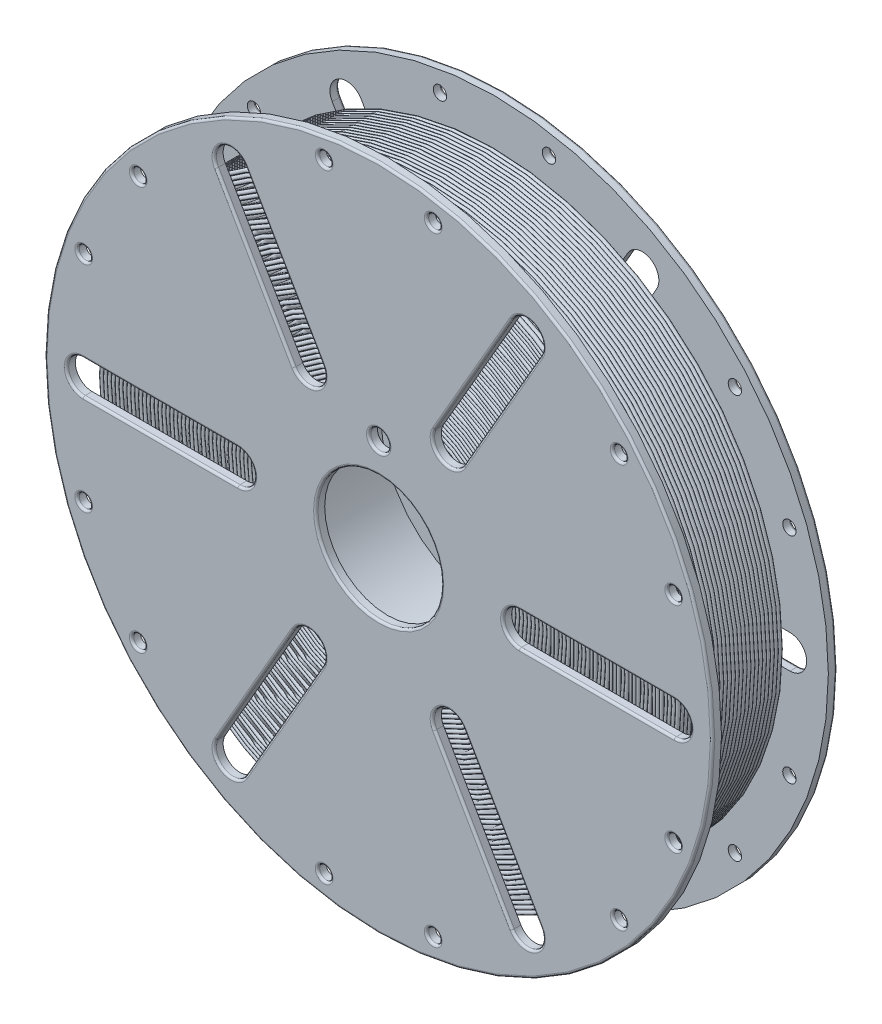
from build123d import *

# Parameters (mm, degrees)
SKETCH1_R           = 150
SKETCH1_R_2         = 28.25
SKETCH1_R_3         = 3
SKETCH1_R_4         = 4.5
BOSS_EXTRUDE1_DEPTH = 4
FILLET1_R           = 1
EXTRUDE_THIN1_START = -24
SKETCH2_R           = 55
SKETCH2_R_2         = 51
EXTRUDE_THIN1_DEPTH = 48


with BuildPart() as part:
    # Sketch1 → Boss-Extrude1 (new body)
    with BuildSketch(Plane.XY):
        Circle(SKETCH1_R)
        Circle(SKETCH1_R_2, mode=Mode.SUBTRACT)
        with Locations((132.496659531, -48.224840209)):
            Circle(SKETCH1_R_3, mode=Mode.SUBTRACT)
        with Locations((108.01226648, -90.633052966)):
            Circle(SKETCH1_R_3, mode=Mode.SUBTRACT)
        with Locations((24.484393051, -138.857893175)):
            Circle(SKETCH1_R_3, mode=Mode.SUBTRACT)
        with Locations((-24.484393051, -138.857893175)):
            Circle(SKETCH1_R_3, mode=Mode.SUBTRACT)
        with Locations((-108.01226648, -90.633052966)):
            Circle(SKETCH1_R_3, mode=Mode.SUBTRACT)
        with Locations((-132.496659531, -48.224840209)):
            Circle(SKETCH1_R_3, mode=Mode.SUBTRACT)
        with Locations((-132.496659531, 48.224840209)):
            Circle(SKETCH1_R_3, mode=Mode.SUBTRACT)
        with Locations((-108.01226648, 90.633052966)):
            Circle(SKETCH1_R_3, mode=Mode.SUBTRACT)
        with Locations((-24.484393051, 138.857893175)):
            Circle(SKETCH1_R_3, mode=Mode.SUBTRACT)
        with Locations((24.484393051, 138.857893175)):
            Circle(SKETCH1_R_3, mode=Mode.SUBTRACT)
        with Locations((108.01226648, 90.633052966)):
            Circle(SKETCH1_R_3, mode=Mode.SUBTRACT)
        with Locations((132.496659531, 48.224840209)):
            Circle(SKETCH1_R_3, mode=Mode.SUBTRACT)
        with Locations((0, 41.75)):
            Circle(SKETCH1_R_4, mode=Mode.SUBTRACT)
        with BuildLine():
            Line((63.25, 7.5), (132.75, 7.5))
            ThreePointArc((132.75, 7.5), (140.25, 0), (132.75, -7.5))
            Line((132.75, -7.5), (63.25, -7.5))
            ThreePointArc((63.25, -7.5), (55.75, 0), (63.25, 7.5))
        make_face(mode=Mode.SUBTRACT)
        with BuildLine():
            Line((38.120190528, -51.026106789), (72.870190528, -111.214872352))
            ThreePointArc((72.870190528, -111.214872352), (70.125, -121.460062881), (59.879809472, -118.714872352))
            Line((59.879809472, -118.714872352), (25.129809472, -58.526106789))
            ThreePointArc((25.129809472, -58.526106789), (27.875, -48.280916261), (38.120190528, -51.026106789))
        make_face(mode=Mode.SUBTRACT)
        with BuildLine():
            Line((-25.129809472, -58.526106789), (-59.879809472, -118.714872352))
            ThreePointArc((-59.879809472, -118.714872352), (-70.125, -121.460062881), (-72.870190528, -111.214872352))
            Line((-72.870190528, -111.214872352), (-38.120190528, -51.026106789))
            ThreePointArc((-38.120190528, -51.026106789), (-27.875, -48.280916261), (-25.129809472, -58.526106789))
        make_face(mode=Mode.SUBTRACT)
        with BuildLine():
            Line((-63.25, -7.5), (-132.75, -7.5))
            ThreePointArc((-132.75, -7.5), (-140.25, 0), (-132.75, 7.5))
            Line((-132.75, 7.5), (-63.25, 7.5))
            ThreePointArc((-63.25, 7.5), (-55.75, 0), (-63.25, -7.5))
        make_face(mode=Mode.SUBTRACT)
        with BuildLine():
            Line((-38.120190528, 51.026106789), (-72.870190528, 111.214872352))
            ThreePointArc((-72.870190528, 111.214872352), (-70.125, 121.460062881), (-59.879809472, 118.714872352))
            Line((-59.879809472, 118.714872352), (-25.129809472, 58.526106789))
            ThreePointArc((-25.129809472, 58.526106789), (-27.875, 48.280916261), (-38.120190528, 51.026106789))
        make_face(mode=Mode.SUBTRACT)
        with BuildLine():
            Line((25.129809472, 58.526106789), (59.879809472, 118.714872352))
            ThreePointArc((59.879809472, 118.714872352), (70.125, 121.460062881), (72.870190528, 111.214872352))
            Line((72.870190528, 111.214872352), (38.120190528, 51.026106789))
            ThreePointArc((38.120190528, 51.026106789), (27.875, 48.280916261), (25.129809472, 58.526106789))
        make_face(mode=Mode.SUBTRACT)
    extrude(amount=BOSS_EXTRUDE1_DEPTH)

    # Fillet1
    fillet1_edges = [part.edges().sort_by_distance(p)[0] for p in [
        (-111.01226648, -90.633052966, 0),
        (-135.496659531, -48.224840209, 0),
        (-135.496659531, 48.224840209, 0),
        (-111.01226648, 90.633052966, 0),
        (-27.484393051, 138.857893175, 0),
        (21.484393051, 138.857893175, 0),
        (105.01226648, 90.633052966, 0),
        (129.496659531, 48.224840209, 0),
        (-4.5, 41.75, 0),
        (55.75, 0, 0),
        (98, -7.5, 0),
        (140.25, 0, 0),
        (98, 7.5, 0),
        (-150, 0, 0),
        (105.01226648, -90.633052966, 0),
        (27.875, -48.280916261, 0),
        (42.504809472, -88.620489571, 0),
        (70.125, -121.460062881, 0),
        (55.495190528, -81.120489571, 0),
        (-27.875, -48.280916261, 0),
        (-55.495190528, -81.120489571, 0),
        (-70.125, -121.460062881, 0),
        (-42.504809472, -88.620489571, 0),
        (-28.25, 0, 0),
        (-55.75, 0, 0),
        (-98, 7.5, 0),
        (-140.25, 0, 0),
        (-98, -7.5, 0),
        (-27.875, 48.280916261, 0),
        (-42.504809472, 88.620489571, 0),
        (-70.125, 121.460062881, 0),
        (-55.495190528, 81.120489571, 0),
        (27.875, 48.280916261, 0),
        (55.495190528, 81.120489571, 0),
        (70.125, 121.460062881, 0),
        (42.504809472, 88.620489571, 0),
        (129.496659531, -48.224840209, 0),
        (21.484393051, -138.857893175, 0),
        (-27.484393051, -138.857893175, 0),
    ]]
    fillet(fillet1_edges, radius=FILLET1_R)


with BuildPart() as body_2:
    # Mirror2: mirrored copy
    add(part.part.mirror(Plane.XY.offset(28)))


with BuildPart() as part_1:
    add(part.part)

    add(body_2.part)  # Extrude-Thin1 merges body 2
    # Sketch2 → Extrude-Thin1 (add)
    with BuildSketch(Plane.XY.offset(28).offset(EXTRUDE_THIN1_START)):
        Circle(SKETCH2_R)
        Circle(SKETCH2_R_2, mode=Mode.SUBTRACT)
    extrude(amount=EXTRUDE_THIN1_DEPTH)


with BuildPart() as body_2_2:
    # Sketch3 → Revolve1 (revolve)
    with BuildSketch(Plane(origin=(0, 0, 0), x_dir=(0, 0, -1), z_dir=(1, 0, 0)), mode=Mode.PRIVATE) as revolve1_sk:
        with BuildLine():
            Line((-50.787875711, 55), (-5.287875711, 55))
            ThreePointArc((-5.287875711, 55), (-4.412875711, 55.875), (-5.287875711, 56.75))
            ThreePointArc((-5.287875711, 56.75), (-4.412875711, 57.625), (-5.287875711, 58.5))
            ThreePointArc((-5.287875711, 58.5), (-4.412875711, 59.375), (-5.287875711, 60.25))
            ThreePointArc((-5.287875711, 60.25), (-4.412875711, 61.125), (-5.287875711, 62))
            ThreePointArc((-5.287875711, 62), (-4.412875711, 62.875), (-5.287875711, 63.75))
            ThreePointArc((-5.287875711, 63.75), (-4.412875711, 64.625), (-5.287875711, 65.5))
            ThreePointArc((-5.287875711, 65.5), (-4.412875711, 66.375), (-5.287875711, 67.25))
            ThreePointArc((-5.287875711, 67.25), (-4.412875711, 68.125), (-5.287875711, 69))
            ThreePointArc((-5.287875711, 69), (-4.412875711, 69.875), (-5.287875711, 70.75))
            ThreePointArc((-5.287875711, 70.75), (-4.412875711, 71.625), (-5.287875711, 72.5))
            ThreePointArc((-5.287875711, 72.5), (-4.412875711, 73.375), (-5.287875711, 74.25))
            ThreePointArc((-5.287875711, 74.25), (-4.412875711, 75.125), (-5.287875711, 76))
            ThreePointArc((-5.287875711, 76), (-4.412875711, 76.875), (-5.287875711, 77.75))
            ThreePointArc((-5.287875711, 77.75), (-4.412875711, 78.625), (-5.287875711, 79.5))
            ThreePointArc((-5.287875711, 79.5), (-4.412875711, 80.375), (-5.287875711, 81.25))
            ThreePointArc((-5.287875711, 81.25), (-4.412875711, 82.125), (-5.287875711, 83))
            ThreePointArc((-5.287875711, 83), (-4.412875711, 83.875), (-5.287875711, 84.75))
            ThreePointArc((-5.287875711, 84.75), (-4.412875711, 85.625), (-5.287875711, 86.5))
            ThreePointArc((-5.287875711, 86.5), (-4.412875711, 87.375), (-5.287875711, 88.25))
            ThreePointArc((-5.287875711, 88.25), (-4.412875711, 89.125), (-5.287875711, 90))
            ThreePointArc((-5.287875711, 90), (-4.412875711, 90.875), (-5.287875711, 91.75))
            ThreePointArc((-5.287875711, 91.75), (-4.412875711, 92.625), (-5.287875711, 93.5))
            ThreePointArc((-5.287875711, 93.5), (-4.412875711, 94.375), (-5.287875711, 95.25))
            ThreePointArc((-5.287875711, 95.25), (-4.412875711, 96.125), (-5.287875711, 97))
            ThreePointArc((-5.287875711, 97), (-4.412875711, 97.875), (-5.287875711, 98.75))
            ThreePointArc((-5.287875711, 98.75), (-4.412875711, 99.625), (-5.287875711, 100.5))
            ThreePointArc((-5.287875711, 100.5), (-4.412875711, 101.375), (-5.287875711, 102.25))
            ThreePointArc((-5.287875711, 102.25), (-4.412875711, 103.125), (-5.287875711, 104))
            ThreePointArc((-5.287875711, 104), (-4.412875711, 104.875), (-5.287875711, 105.75))
            ThreePointArc((-5.287875711, 105.75), (-4.412875711, 106.625), (-5.287875711, 107.5))
            ThreePointArc((-5.287875711, 107.5), (-4.412875711, 108.375), (-5.287875711, 109.25))
            ThreePointArc((-5.287875711, 109.25), (-4.412875711, 110.125), (-5.287875711, 111))
            ThreePointArc((-5.287875711, 111), (-4.412875711, 111.875), (-5.287875711, 112.75))
            ThreePointArc((-5.287875711, 112.75), (-4.412875711, 113.625), (-5.287875711, 114.5))
            ThreePointArc((-5.287875711, 114.5), (-4.412875711, 115.375), (-5.287875711, 116.25))
            ThreePointArc((-5.287875711, 116.25), (-4.412875711, 117.125), (-5.287875711, 118))
            ThreePointArc((-5.287875711, 118), (-4.412875711, 118.875), (-5.287875711, 119.75))
            ThreePointArc((-5.287875711, 119.75), (-4.412875711, 120.625), (-5.287875711, 121.5))
            ThreePointArc((-5.287875711, 121.5), (-4.412875711, 122.375), (-5.287875711, 123.25))
            ThreePointArc((-5.287875711, 123.25), (-4.412875711, 124.125), (-5.287875711, 125))
            ThreePointArc((-5.287875711, 125), (-4.412875711, 125.875), (-5.287875711, 126.75))
            ThreePointArc((-5.287875711, 126.75), (-4.412875711, 127.625), (-5.287875711, 128.5))
            ThreePointArc((-5.287875711, 128.5), (-4.669157278, 129.993718434), (-6.162875711, 129.375))
            ThreePointArc((-6.162875711, 129.375), (-7.037875711, 130.25), (-7.912875711, 129.375))
            ThreePointArc((-7.912875711, 129.375), (-8.787875711, 130.25), (-9.662875711, 129.375))
            ThreePointArc((-9.662875711, 129.375), (-10.537875711, 130.25), (-11.412875711, 129.375))
            ThreePointArc((-11.412875711, 129.375), (-12.287875711, 130.25), (-13.162875711, 129.375))
            ThreePointArc((-13.162875711, 129.375), (-14.037875711, 130.25), (-14.912875711, 129.375))
            ThreePointArc((-14.912875711, 129.375), (-15.787875711, 130.25), (-16.662875711, 129.375))
            ThreePointArc((-16.662875711, 129.375), (-17.537875711, 130.25), (-18.412875711, 129.375))
            ThreePointArc((-18.412875711, 129.375), (-19.287875711, 130.25), (-20.162875711, 129.375))
            ThreePointArc((-20.162875711, 129.375), (-21.037875711, 130.25), (-21.912875711, 129.375))
            ThreePointArc((-21.912875711, 129.375), (-22.787875711, 130.25), (-23.662875711, 129.375))
            ThreePointArc((-23.662875711, 129.375), (-24.537875711, 130.25), (-25.412875711, 129.375))
            ThreePointArc((-25.412875711, 129.375), (-26.287875711, 130.25), (-27.162875711, 129.375))
            ThreePointArc((-27.162875711, 129.375), (-28.037875711, 130.25), (-28.912875711, 129.375))
            ThreePointArc((-28.912875711, 129.375), (-29.787875711, 130.25), (-30.662875711, 129.375))
            ThreePointArc((-30.662875711, 129.375), (-31.537875711, 130.25), (-32.412875711, 129.375))
            ThreePointArc((-32.412875711, 129.375), (-33.287875711, 130.25), (-34.162875711, 129.375))
            ThreePointArc((-34.162875711, 129.375), (-35.037875711, 130.25), (-35.912875711, 129.375))
            ThreePointArc((-35.912875711, 129.375), (-36.787875711, 130.25), (-37.662875711, 129.375))
            ThreePointArc((-37.662875711, 129.375), (-38.537875711, 130.25), (-39.412875711, 129.375))
            ThreePointArc((-39.412875711, 129.375), (-40.287875711, 130.25), (-41.162875711, 129.375))
            ThreePointArc((-41.162875711, 129.375), (-42.037875711, 130.25), (-42.912875711, 129.375))
            ThreePointArc((-42.912875711, 129.375), (-43.787875711, 130.25), (-44.662875711, 129.375))
            ThreePointArc((-44.662875711, 129.375), (-45.537875711, 130.25), (-46.412875711, 129.375))
            ThreePointArc((-46.412875711, 129.375), (-47.287875711, 130.25), (-48.162875711, 129.375))
            ThreePointArc((-48.162875711, 129.375), (-49.037875711, 130.25), (-49.912875711, 129.375))
            ThreePointArc((-49.912875711, 129.375), (-51.406594145, 129.993718434), (-50.787875711, 128.5))
            ThreePointArc((-50.787875711, 128.5), (-51.662875711, 127.625), (-50.787875711, 126.75))
            ThreePointArc((-50.787875711, 126.75), (-51.662875711, 125.875), (-50.787875711, 125))
            ThreePointArc((-50.787875711, 125), (-51.662875711, 124.125), (-50.787875711, 123.25))
            ThreePointArc((-50.787875711, 123.25), (-51.662875711, 122.375), (-50.787875711, 121.5))
            ThreePointArc((-50.787875711, 121.5), (-51.662875711, 120.625), (-50.787875711, 119.75))
            ThreePointArc((-50.787875711, 119.75), (-51.662875711, 118.875), (-50.787875711, 118))
            ThreePointArc((-50.787875711, 118), (-51.662875711, 117.125), (-50.787875711, 116.25))
            ThreePointArc((-50.787875711, 116.25), (-51.662875711, 115.375), (-50.787875711, 114.5))
            ThreePointArc((-50.787875711, 114.5), (-51.662875711, 113.625), (-50.787875711, 112.75))
            ThreePointArc((-50.787875711, 112.75), (-51.662875711, 111.875), (-50.787875711, 111))
            ThreePointArc((-50.787875711, 111), (-51.662875711, 110.125), (-50.787875711, 109.25))
            ThreePointArc((-50.787875711, 109.25), (-51.662875711, 108.375), (-50.787875711, 107.5))
            ThreePointArc((-50.787875711, 107.5), (-51.662875711, 106.625), (-50.787875711, 105.75))
            ThreePointArc((-50.787875711, 105.75), (-51.662875711, 104.875), (-50.787875711, 104))
            ThreePointArc((-50.787875711, 104), (-51.662875711, 103.125), (-50.787875711, 102.25))
            ThreePointArc((-50.787875711, 102.25), (-51.662875711, 101.375), (-50.787875711, 100.5))
            ThreePointArc((-50.787875711, 100.5), (-51.662875711, 99.625), (-50.787875711, 98.75))
            ThreePointArc((-50.787875711, 98.75), (-51.662875711, 97.875), (-50.787875711, 97))
            ThreePointArc((-50.787875711, 97), (-51.662875711, 96.125), (-50.787875711, 95.25))
            ThreePointArc((-50.787875711, 95.25), (-51.662875711, 94.375), (-50.787875711, 93.5))
            ThreePointArc((-50.787875711, 93.5), (-51.662875711, 92.625), (-50.787875711, 91.75))
            ThreePointArc((-50.787875711, 91.75), (-51.662875711, 90.875), (-50.787875711, 90))
            ThreePointArc((-50.787875711, 90), (-51.662875711, 89.125), (-50.787875711, 88.25))
            ThreePointArc((-50.787875711, 88.25), (-51.662875711, 87.375), (-50.787875711, 86.5))
            ThreePointArc((-50.787875711, 86.5), (-51.662875711, 85.625), (-50.787875711, 84.75))
            ThreePointArc((-50.787875711, 84.75), (-51.662875711, 83.875), (-50.787875711, 83))
            ThreePointArc((-50.787875711, 83), (-51.662875711, 82.125), (-50.787875711, 81.25))
            ThreePointArc((-50.787875711, 81.25), (-51.662875711, 80.375), (-50.787875711, 79.5))
            ThreePointArc((-50.787875711, 79.5), (-51.662875711, 78.625), (-50.787875711, 77.75))
            ThreePointArc((-50.787875711, 77.75), (-51.662875711, 76.875), (-50.787875711, 76))
            ThreePointArc((-50.787875711, 76), (-51.662875711, 75.125), (-50.787875711, 74.25))
            ThreePointArc((-50.787875711, 74.25), (-51.662875711, 73.375), (-50.787875711, 72.5))
            ThreePointArc((-50.787875711, 72.5), (-51.662875711, 71.625), (-50.787875711, 70.75))
            ThreePointArc((-50.787875711, 70.75), (-51.662875711, 69.875), (-50.787875711, 69))
            ThreePointArc((-50.787875711, 69), (-51.662875711, 68.125), (-50.787875711, 67.25))
            ThreePointArc((-50.787875711, 67.25), (-51.662875711, 66.375), (-50.787875711, 65.5))
            ThreePointArc((-50.787875711, 65.5), (-51.662875711, 64.625), (-50.787875711, 63.75))
            ThreePointArc((-50.787875711, 63.75), (-51.662875711, 62.875), (-50.787875711, 62))
            ThreePointArc((-50.787875711, 62), (-51.662875711, 61.125), (-50.787875711, 60.25))
            ThreePointArc((-50.787875711, 60.25), (-51.662875711, 59.375), (-50.787875711, 58.5))
            ThreePointArc((-50.787875711, 58.5), (-51.662875711, 57.625), (-50.787875711, 56.75))
            ThreePointArc((-50.787875711, 56.75), (-51.662875711, 55.875), (-50.787875711, 55))
        make_face()
    revolve(revolve1_sk.sketch.rotate(Axis((0, 0, 0), (0, 0, 1)), 90), axis=Axis((0, 0, 0), (0, 0, 1)))


solid = Compound([part_1.part, body_2_2.part])
